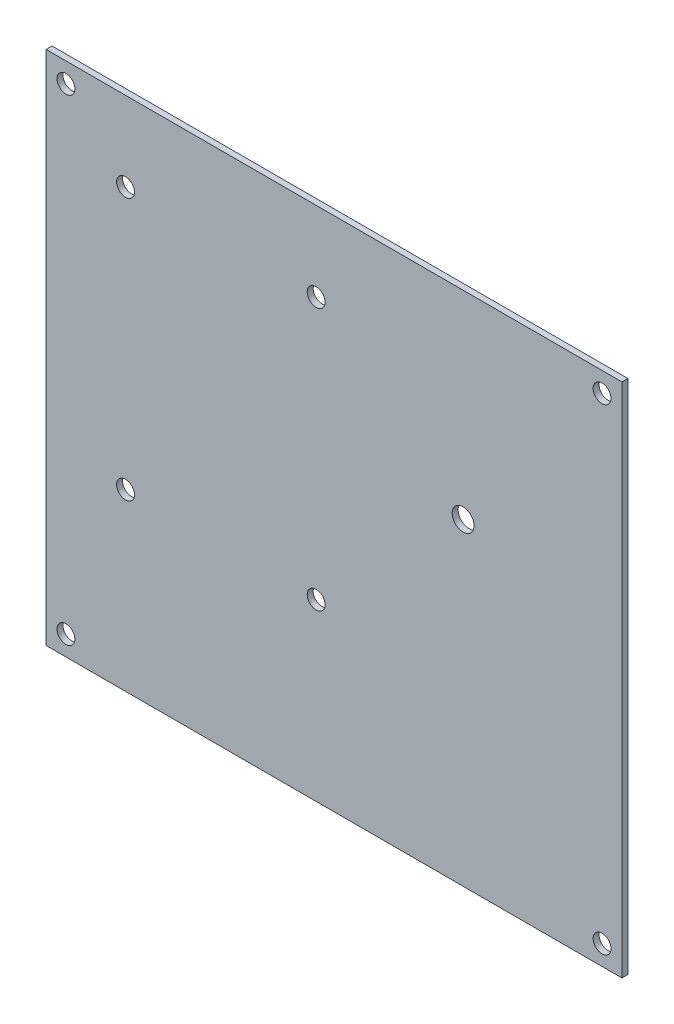
from build123d import *

# Parameters (mm, degrees)
SKETCH_1_W      = 145
SKETCH_1_H      = 130
SKETCH_1_R      = 2.25
SKETCH_1_R_2    = 2.75
EXTRUDE_1_DEPTH = 1.5


with BuildPart() as part:
    # Эскиз1 → Вытянуть1 (new body)
    with BuildSketch(Plane.XY):
        Rectangle(SKETCH_1_W, SKETCH_1_H)
        with Locations((-67.5, 60)):
            Circle(SKETCH_1_R, mode=Mode.SUBTRACT)
        with Locations(Location((-67.5, -60, 0), (0, 0, 180))):
            Circle(SKETCH_1_R, mode=Mode.SUBTRACT)
        with Locations((67.5, -60)):
            Circle(SKETCH_1_R, mode=Mode.SUBTRACT)
        with Locations(Location((67.5, 60, 0), (0, 0, 180))):
            Circle(SKETCH_1_R, mode=Mode.SUBTRACT)
        with Locations((-52.5, 45)):
            Circle(SKETCH_1_R, mode=Mode.SUBTRACT)
        with Locations(Location((-52.5, -21, 0), (0, 0, 180))):
            Circle(SKETCH_1_R, mode=Mode.SUBTRACT)
        with Locations((-4.5, 45)):
            Circle(SKETCH_1_R, mode=Mode.SUBTRACT)
        with Locations(Location((-4.5, -21, 0), (0, 0, 180))):
            Circle(SKETCH_1_R, mode=Mode.SUBTRACT)
        with Locations((32.5, 15)):
            Circle(SKETCH_1_R_2, mode=Mode.SUBTRACT)
    extrude(amount=EXTRUDE_1_DEPTH)


solid = part.part
